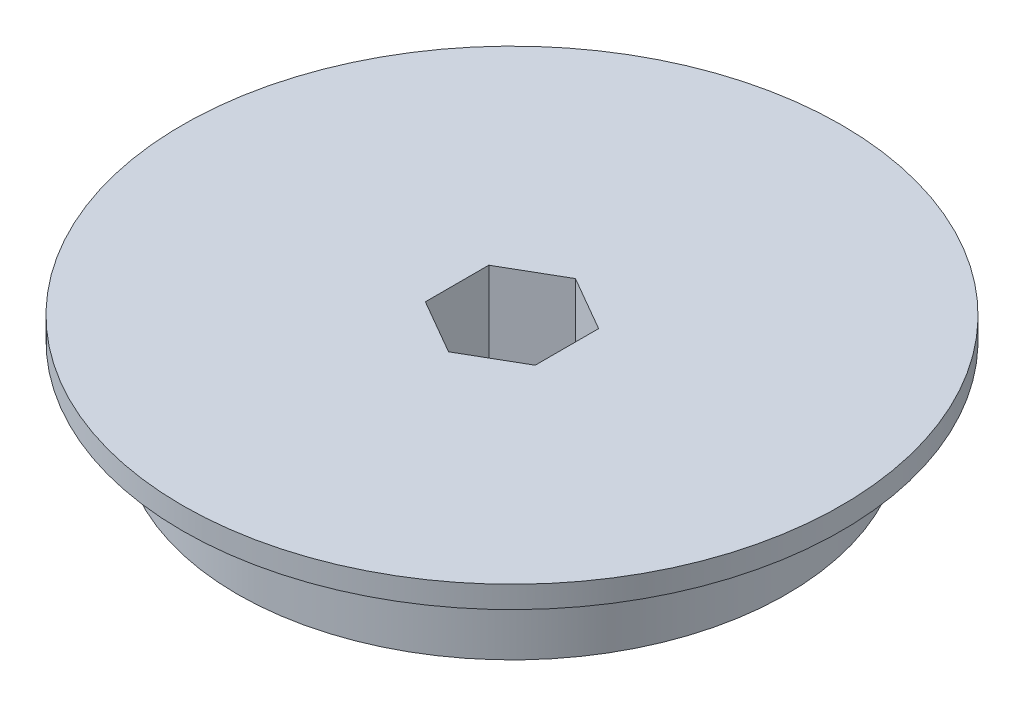
from build123d import *

# Parameters (mm, degrees)
SKETCH1_R           = 10
BOSS_EXTRUDE1_DEPTH = 3
SKETCH3_R           = 12
BOSS_EXTRUDE2_DEPTH = 0.8
CUT_EXTRUDE1_DEPTH  = 18.390802167
CHAMFER1_SIZE       = 0.4


with BuildPart() as part:
    # Sketch1 → Boss-Extrude1 (new body)
    with BuildSketch(Plane(origin=(0, 0, 0), x_dir=(1, 0, 0), z_dir=(0, 1, 0))):
        with Locations(Location((0, 0, 0), (0, 0, 270))):
            Circle(SKETCH1_R)
        Polygon((0, 2.309401077), (-2, 1.154700538), (-2, -1.154700538), (0, -2.309401077), (2, -1.154700538), (2, 1.154700538), align=None, mode=Mode.SUBTRACT)
    extrude(amount=BOSS_EXTRUDE1_DEPTH)

    # Sketch3 → Boss-Extrude2 (add)
    with BuildSketch(Plane(origin=(0, 3, 0), x_dir=(1, 0, 0), z_dir=(0, 1, 0))):
        with Locations(Location((0, 0, 0), (0, 0, 270))):
            Circle(SKETCH3_R)
    extrude(amount=BOSS_EXTRUDE2_DEPTH)

    # Sketch4 → Cut-Extrude1 (cut, through all)
    with BuildSketch(Plane.XZ):
        Polygon((0, -2.309401077), (2, -1.154700538), (2, 1.154700538), (0, 2.309401077), (-2, 1.154700538), (-2, -1.154700538), align=None)
    extrude(amount=-CUT_EXTRUDE1_DEPTH, mode=Mode.SUBTRACT)

    # Chamfer1
    chamfer1_edges = [part.edges().sort_by_distance(p)[0] for p in [
        (0, 3, -10),
    ]]
    chamfer(chamfer1_edges, length=CHAMFER1_SIZE)


solid = part.part
